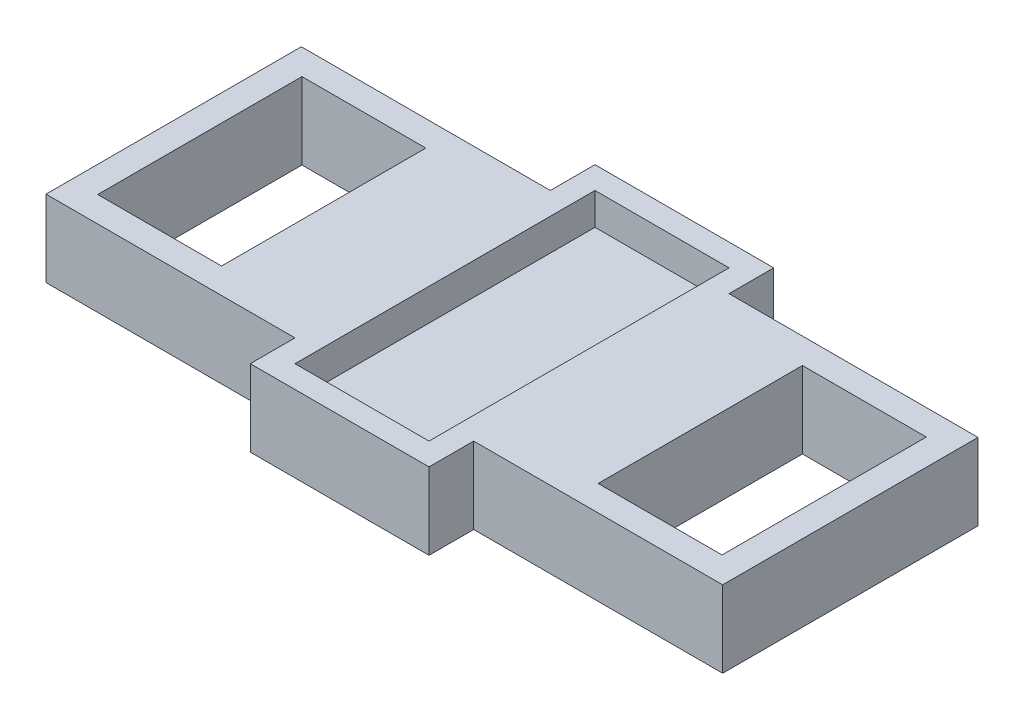
from build123d import *

# Parameters (mm, degrees)
DODANIE_WYCI_GNI_CIE1_DEPTH = 6
WYTNIJ_WYCI_GNI_CIE1_REACH  = 32.34
SZKIC2_W                    = 9.7
SZKIC2_H                    = 16
SZKIC4_W                    = 10.5
SZKIC4_H                    = 23.5
WYTNIJ_WYCI_GNI_CIE3_DEPTH  = 2.5


with BuildPart() as part:
    # Szkic1 → Dodanie-wyciągnięcie1 (new body)
    with BuildSketch(Plane(origin=(0, 0, 0), x_dir=(1, 0, 0), z_dir=(0, 1, 0))):
        Polygon((-7, 10), (-7, 13.5), (7, 13.5), (7, 10), (26.5, 10), (26.5, -10), (7, -10), (7, -13.5), (-7, -13.5), (-7, -10), (-26.5, -10), (-26.5, 10), align=None)
    extrude(amount=DODANIE_WYCI_GNI_CIE1_DEPTH)

    # Szkic2 → Wytnij-wyciągnięcie1 (cut, up to next)
    with BuildSketch(Plane(origin=(0, 6, 0), x_dir=(1, 0, 0), z_dir=(0, 1, 0)), mode=Mode.PRIVATE) as wytnij_wyci_gni_cie1_sk1:
        with Locations((-19.6, 0)):
            Rectangle(SZKIC2_W, SZKIC2_H)
    wytnij_wyci_gni_cie1_tool1 = extrude(wytnij_wyci_gni_cie1_sk1.sketch, amount=-WYTNIJ_WYCI_GNI_CIE1_REACH, mode=Mode.PRIVATE) & part.part
    # Szkic2 → Wytnij-wyciągnięcie1 (cut, up to next)
    with BuildSketch(Plane(origin=(0, 6, 0), x_dir=(1, 0, 0), z_dir=(0, 1, 0)), mode=Mode.PRIVATE) as wytnij_wyci_gni_cie1_sk2:
        with Locations((19.6, 0)):
            Rectangle(SZKIC2_W, SZKIC2_H)
    wytnij_wyci_gni_cie1_tool2 = extrude(wytnij_wyci_gni_cie1_sk2.sketch, amount=-WYTNIJ_WYCI_GNI_CIE1_REACH, mode=Mode.PRIVATE) & part.part
    add(wytnij_wyci_gni_cie1_tool1.solids().sort_by_distance((-19.6, 6, 0))[0], mode=Mode.SUBTRACT)
    add(wytnij_wyci_gni_cie1_tool2.solids().sort_by_distance((19.6, 6, 0))[0], mode=Mode.SUBTRACT)

    # Szkic4 → Wytnij-wyciągnięcie3 (cut)
    with BuildSketch(Plane.XZ.offset(-6)):
        Rectangle(SZKIC4_W, SZKIC4_H)
    extrude(amount=WYTNIJ_WYCI_GNI_CIE3_DEPTH, mode=Mode.SUBTRACT)


solid = part.part
